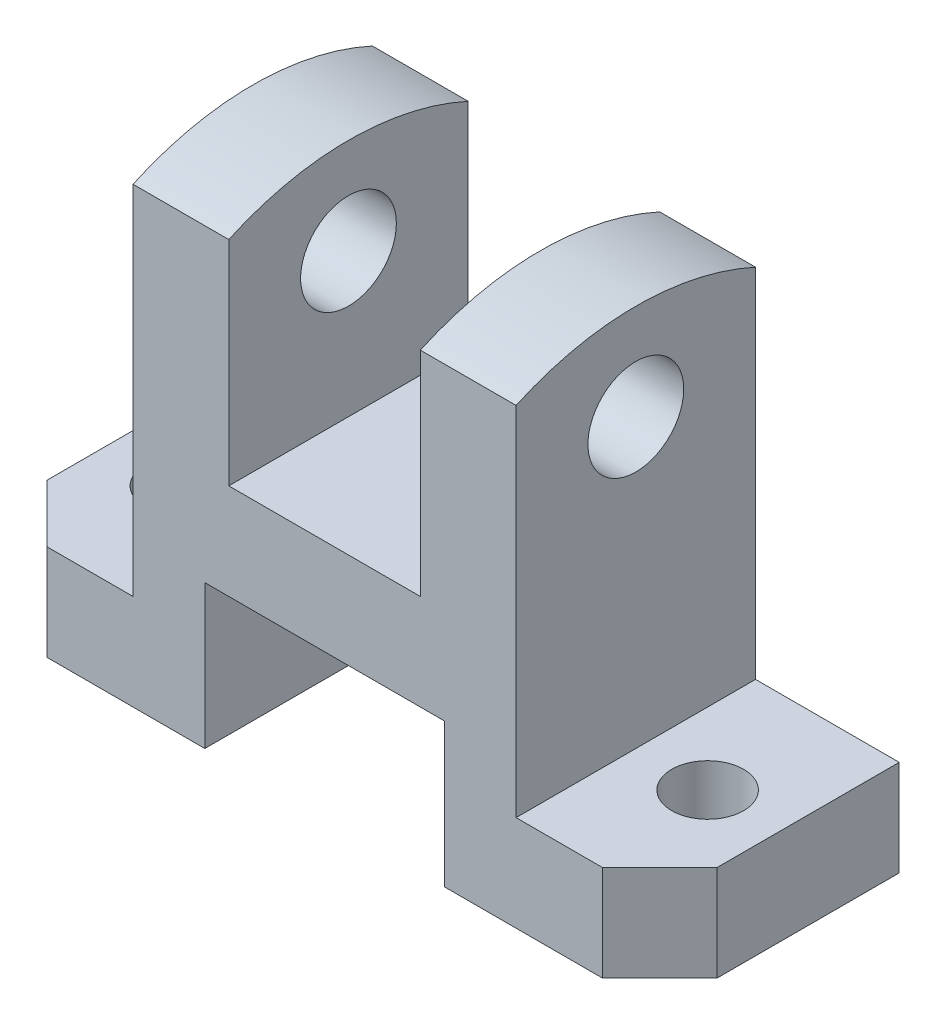
from build123d import *

# Parameters (mm, degrees)
SKETCH1_W           = 19.05
SKETCH1_H           = 12.7
SKETCH1_W_2         = 9.525
SKETCH1_H_2         = 63.5
SKETCH1_W_3         = 3.175
SKETCH1_H_3         = 31.75
BOSS_EXTRUDE1_DEPTH = 31.75
CUT_EXTRUDE1_DEPTH  = 31.75
SKETCH3_R           = 4.7625
CUT_EXTRUDE2_DEPTH  = 31.75
SKETCH4_R           = 6.35
CUT_EXTRUDE3_DEPTH  = 100.595858348


with BuildPart() as part:
    # Sketch1 → Boss-Extrude1 (new body)
    with BuildSketch(Plane.XY):
        with Locations((-19.05, -57.15)):
            Rectangle(SKETCH1_W, SKETCH1_H)
        with Locations((-4.7625, -31.75)):
            Rectangle(SKETCH1_W_2, SKETCH1_H_2)
        with Locations((1.5875, -15.875)):
            Rectangle(SKETCH1_W_3, SKETCH1_H_3)
        Polygon((3.175, -31.75), (0, -31.75), (0, -44.45), (31.75, -44.45), (31.75, -31.75), (28.575, -31.75), align=None)
        with Locations((30.1625, -15.875)):
            Rectangle(SKETCH1_W_3, SKETCH1_H_3)
        Polygon((31.75, -31.75), (31.75, -44.45), (31.75, -63.5), (41.275, -63.5), (41.275, -50.8), (41.275, 0), (31.75, 0), align=None)
        with Locations((50.8, -57.15)):
            Rectangle(SKETCH1_W, SKETCH1_H)
    extrude(amount=BOSS_EXTRUDE1_DEPTH)

    # Sketch2 → Cut-Extrude1 (cut)
    with BuildSketch(Plane(origin=(0, -50.8, 0), x_dir=(1, 0, 0), z_dir=(0, 1, 0))):
        Polygon((-20.955, -31.75), (-28.575, -24.13), (-28.575, -31.75), align=None)
        Polygon((52.705, -31.75), (60.325, -24.13), (60.325, -31.75), align=None)
    extrude(amount=-CUT_EXTRUDE1_DEPTH, mode=Mode.SUBTRACT)

    # Sketch3 → Cut-Extrude2 (cut)
    with BuildSketch(Plane(origin=(0, -50.8, 0), x_dir=(1, 0, 0), z_dir=(0, 1, 0))):
        with Locations(Location((-19.05, -15.875, 0), (0, 0, 270))):
            Circle(SKETCH3_R)
        with Locations(Location((50.8, -15.875, 0), (0, 0, 270))):
            Circle(SKETCH3_R)
    extrude(amount=-CUT_EXTRUDE2_DEPTH, mode=Mode.SUBTRACT)

    # Sketch4 → Cut-Extrude3 (cut, through all)
    with BuildSketch(Plane(origin=(41.275, 0, 0), x_dir=(0, 0, -1), z_dir=(1, 0, 0))):
        with Locations((-15.875, -12.7)):
            Circle(SKETCH4_R)
        with BuildLine():
            Line((0, 0), (-15.875, 0))
            ThreePointArc((-15.875, 0), (-7.750642571, -0.876286908), (0, -3.464839036))
            Line((0, -3.464839036), (0, 0))
        make_face()
        with BuildLine():
            Line((-15.875, 0), (-31.75, 0))
            Line((-31.75, 0), (-31.75, -3.464839036))
            ThreePointArc((-31.75, -3.464839036), (-23.999357429, -0.876286908), (-15.875, 0))
        make_face()
    extrude(amount=-CUT_EXTRUDE3_DEPTH, mode=Mode.SUBTRACT)


solid = part.part
